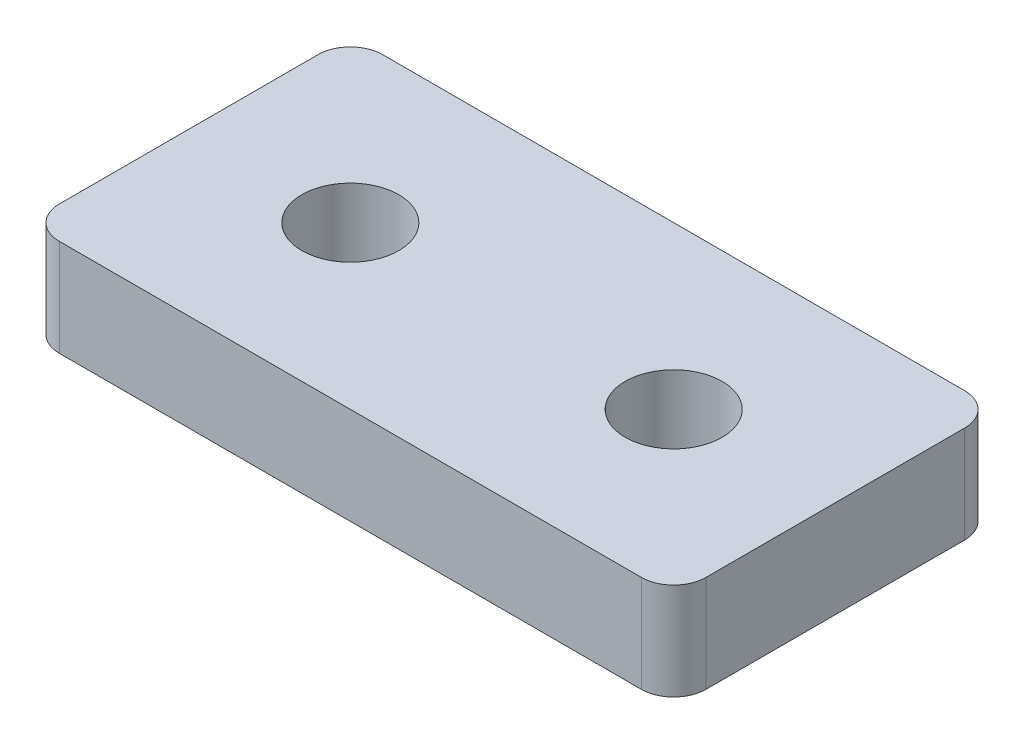
from build123d import *

# Parameters (mm, degrees)
SKETCH1_W           = 20
SKETCH1_H           = 10
SKETCH1_R           = 1.5
BOSS_EXTRUDE1_DEPTH = 3
FILLET1_R           = 1


with BuildPart() as part:
    # Sketch1 → Boss-Extrude1 (new body)
    with BuildSketch(Plane(origin=(0, 0, 0), x_dir=(1, 0, 0), z_dir=(0, 1, 0))):
        with Locations((10, 5)):
            Rectangle(SKETCH1_W, SKETCH1_H)
        with Locations(Location((5, 5, 0), (0, 0, 270))):
            Circle(SKETCH1_R, mode=Mode.SUBTRACT)
        with Locations(Location((15, 5, 0), (0, 0, 270))):
            Circle(SKETCH1_R, mode=Mode.SUBTRACT)
    extrude(amount=BOSS_EXTRUDE1_DEPTH)

    # Fillet1
    fillet1_edges = [part.edges().sort_by_distance(p)[0] for p in [
        (0, 1.5, -10),
        (20, 1.5, -10),
        (20, 1.5, 0),
        (0, 1.5, 0),
    ]]
    fillet(fillet1_edges, radius=FILLET1_R)


solid = part.part
